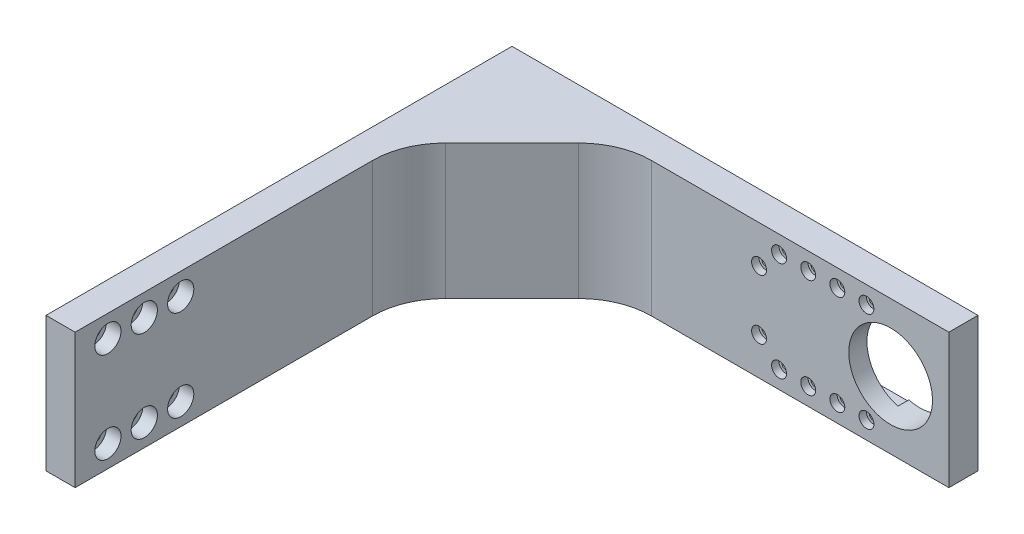
from build123d import *

# Parameters (mm, degrees)
BOSS_EXTRUDE1_DEPTH = 37
CUT_EXTRUDE1_REACH  = 186.762
SKETCH2_R           = 11.5
CUT_EXTRUDE2_REACH  = 186.762
SKETCH3_R           = 1.25
SKETCH5_W           = 38
SKETCH5_H           = 23
CUT_EXTRUDE3_DEPTH  = 3
SKETCH6_W           = 3
SKETCH6_H           = 23
BOSS_EXTRUDE2_DEPTH = 7.5
CUT_EXTRUDE4_REACH  = 184.696
SKETCH7_R           = 1.25
SKETCH8_R           = 2.05
CUT_EXTRUDE5_DEPTH  = 2
CUT_EXTRUDE6_REACH  = 181.313
SKETCH9_R           = 2.25
SKETCH10_R          = 3.6
CUT_EXTRUDE7_DEPTH  = 4
CHAMFER1_SIZE       = 30
FILLET4_R           = 20


with BuildPart() as part:
    # Sketch1 → Boss-Extrude1 (new body)
    with BuildSketch(Plane(origin=(0, 0, 0), x_dir=(1, 0, 0), z_dir=(0, 1, 0))):
        Polygon((0, 0), (0, 128), (128, 128), (128, 120), (8, 120), (8, 0), align=None)
    extrude(amount=BOSS_EXTRUDE1_DEPTH)

    # Sketch2 → Cut-Extrude1 (cut, up to next)
    with BuildSketch(Plane(origin=(0, 0, -128), x_dir=(-1, 0, 0), z_dir=(0, 0, -1)), mode=Mode.PRIVATE) as cut_extrude1_sk1:
        with Locations((-112, 18.5)):
            Circle(SKETCH2_R)
    cut_extrude1_tool1 = extrude(cut_extrude1_sk1.sketch, amount=-CUT_EXTRUDE1_REACH, mode=Mode.PRIVATE) & part.part
    add(cut_extrude1_tool1.solids().sort_by_distance((112, 18.5, -128))[0], mode=Mode.SUBTRACT)

    # Sketch3 → Cut-Extrude2 (cut, up to next)
    with BuildSketch(Plane(origin=(0, 0, -128), x_dir=(-1, 0, 0), z_dir=(0, 0, -1)), mode=Mode.PRIVATE) as cut_extrude2_sk1:
        with Locations((-75.86, 10.31)):
            Circle(SKETCH3_R)
    cut_extrude2_tool1 = extrude(cut_extrude2_sk1.sketch, amount=-CUT_EXTRUDE2_REACH, mode=Mode.PRIVATE) & part.part
    # Sketch3 → Cut-Extrude2 (cut, up to next)
    with BuildSketch(Plane(origin=(0, 0, -128), x_dir=(-1, 0, 0), z_dir=(0, 0, -1)), mode=Mode.PRIVATE) as cut_extrude2_sk2:
        with Locations((-105.36, 32.19)):
            Circle(SKETCH3_R)
    cut_extrude2_tool2 = extrude(cut_extrude2_sk2.sketch, amount=-CUT_EXTRUDE2_REACH, mode=Mode.PRIVATE) & part.part
    # Sketch3 → Cut-Extrude2 (cut, up to next)
    with BuildSketch(Plane(origin=(0, 0, -128), x_dir=(-1, 0, 0), z_dir=(0, 0, -1)), mode=Mode.PRIVATE) as cut_extrude2_sk3:
        with Locations((-97.36, 32.19)):
            Circle(SKETCH3_R)
    cut_extrude2_tool3 = extrude(cut_extrude2_sk3.sketch, amount=-CUT_EXTRUDE2_REACH, mode=Mode.PRIVATE) & part.part
    # Sketch3 → Cut-Extrude2 (cut, up to next)
    with BuildSketch(Plane(origin=(0, 0, -128), x_dir=(-1, 0, 0), z_dir=(0, 0, -1)), mode=Mode.PRIVATE) as cut_extrude2_sk4:
        with Locations((-89.36, 32.19)):
            Circle(SKETCH3_R)
    cut_extrude2_tool4 = extrude(cut_extrude2_sk4.sketch, amount=-CUT_EXTRUDE2_REACH, mode=Mode.PRIVATE) & part.part
    # Sketch3 → Cut-Extrude2 (cut, up to next)
    with BuildSketch(Plane(origin=(0, 0, -128), x_dir=(-1, 0, 0), z_dir=(0, 0, -1)), mode=Mode.PRIVATE) as cut_extrude2_sk5:
        with Locations((-81.36, 32.19)):
            Circle(SKETCH3_R)
    cut_extrude2_tool5 = extrude(cut_extrude2_sk5.sketch, amount=-CUT_EXTRUDE2_REACH, mode=Mode.PRIVATE) & part.part
    # Sketch3 → Cut-Extrude2 (cut, up to next)
    with BuildSketch(Plane(origin=(0, 0, -128), x_dir=(-1, 0, 0), z_dir=(0, 0, -1)), mode=Mode.PRIVATE) as cut_extrude2_sk6:
        with Locations((-81.36, 4.81)):
            Circle(SKETCH3_R)
    cut_extrude2_tool6 = extrude(cut_extrude2_sk6.sketch, amount=-CUT_EXTRUDE2_REACH, mode=Mode.PRIVATE) & part.part
    # Sketch3 → Cut-Extrude2 (cut, up to next)
    with BuildSketch(Plane(origin=(0, 0, -128), x_dir=(-1, 0, 0), z_dir=(0, 0, -1)), mode=Mode.PRIVATE) as cut_extrude2_sk7:
        with Locations((-89.36, 4.81)):
            Circle(SKETCH3_R)
    cut_extrude2_tool7 = extrude(cut_extrude2_sk7.sketch, amount=-CUT_EXTRUDE2_REACH, mode=Mode.PRIVATE) & part.part
    # Sketch3 → Cut-Extrude2 (cut, up to next)
    with BuildSketch(Plane(origin=(0, 0, -128), x_dir=(-1, 0, 0), z_dir=(0, 0, -1)), mode=Mode.PRIVATE) as cut_extrude2_sk8:
        with Locations((-97.36, 4.81)):
            Circle(SKETCH3_R)
    cut_extrude2_tool8 = extrude(cut_extrude2_sk8.sketch, amount=-CUT_EXTRUDE2_REACH, mode=Mode.PRIVATE) & part.part
    # Sketch3 → Cut-Extrude2 (cut, up to next)
    with BuildSketch(Plane(origin=(0, 0, -128), x_dir=(-1, 0, 0), z_dir=(0, 0, -1)), mode=Mode.PRIVATE) as cut_extrude2_sk9:
        with Locations((-105.36, 4.81)):
            Circle(SKETCH3_R)
    cut_extrude2_tool9 = extrude(cut_extrude2_sk9.sketch, amount=-CUT_EXTRUDE2_REACH, mode=Mode.PRIVATE) & part.part
    # Sketch3 → Cut-Extrude2 (cut, up to next)
    with BuildSketch(Plane(origin=(0, 0, -128), x_dir=(-1, 0, 0), z_dir=(0, 0, -1)), mode=Mode.PRIVATE) as cut_extrude2_sk10:
        with Locations((-75.86, 26.69)):
            Circle(SKETCH3_R)
    cut_extrude2_tool10 = extrude(cut_extrude2_sk10.sketch, amount=-CUT_EXTRUDE2_REACH, mode=Mode.PRIVATE) & part.part
    add(cut_extrude2_tool1.solids().sort_by_distance((75.86, 10.31, -128))[0], mode=Mode.SUBTRACT)
    add(cut_extrude2_tool2.solids().sort_by_distance((105.36, 32.19, -128))[0], mode=Mode.SUBTRACT)
    add(cut_extrude2_tool3.solids().sort_by_distance((97.36, 32.19, -128))[0], mode=Mode.SUBTRACT)
    add(cut_extrude2_tool4.solids().sort_by_distance((89.36, 32.19, -128))[0], mode=Mode.SUBTRACT)
    add(cut_extrude2_tool5.solids().sort_by_distance((81.36, 32.19, -128))[0], mode=Mode.SUBTRACT)
    add(cut_extrude2_tool6.solids().sort_by_distance((81.36, 4.81, -128))[0], mode=Mode.SUBTRACT)
    add(cut_extrude2_tool7.solids().sort_by_distance((89.36, 4.81, -128))[0], mode=Mode.SUBTRACT)
    add(cut_extrude2_tool8.solids().sort_by_distance((97.36, 4.81, -128))[0], mode=Mode.SUBTRACT)
    add(cut_extrude2_tool9.solids().sort_by_distance((105.36, 4.81, -128))[0], mode=Mode.SUBTRACT)
    add(cut_extrude2_tool10.solids().sort_by_distance((75.86, 26.69, -128))[0], mode=Mode.SUBTRACT)

    # Sketch5 → Cut-Extrude3 (cut)
    with BuildSketch(Plane(origin=(0, 0, -128), x_dir=(-1, 0, 0), z_dir=(0, 0, -1))):
        with Locations((-90, 18.5)):
            Rectangle(SKETCH5_W, SKETCH5_H)
    extrude(amount=-CUT_EXTRUDE3_DEPTH, mode=Mode.SUBTRACT)

    # Sketch6 → Boss-Extrude2 (add)
    with BuildSketch(Plane(origin=(71, 0, 0), x_dir=(0, 0, -1), z_dir=(1, 0, 0))):
        with Locations((126.5, 18.5)):
            Rectangle(SKETCH6_W, SKETCH6_H)
    extrude(amount=BOSS_EXTRUDE2_DEPTH)

    # Sketch7 → Cut-Extrude4 (cut, up to next)
    with BuildSketch(Plane.XY.offset(-125), mode=Mode.PRIVATE) as cut_extrude4_sk1:
        with Locations(Location((75.86, 10.31, 0), (0, 0, 180))):
            Circle(SKETCH7_R)
    cut_extrude4_tool1 = extrude(cut_extrude4_sk1.sketch, amount=-CUT_EXTRUDE4_REACH, mode=Mode.PRIVATE) & part.part
    # Sketch7 → Cut-Extrude4 (cut, up to next)
    with BuildSketch(Plane.XY.offset(-125), mode=Mode.PRIVATE) as cut_extrude4_sk2:
        with Locations(Location((75.86, 26.69, 0), (0, 0, 180))):
            Circle(SKETCH7_R)
    cut_extrude4_tool2 = extrude(cut_extrude4_sk2.sketch, amount=-CUT_EXTRUDE4_REACH, mode=Mode.PRIVATE) & part.part
    add(cut_extrude4_tool1.solids().sort_by_distance((75.86, 10.31, -125))[0], mode=Mode.SUBTRACT)
    add(cut_extrude4_tool2.solids().sort_by_distance((75.86, 26.69, -125))[0], mode=Mode.SUBTRACT)

    # Sketch8 → Cut-Extrude5 (cut)
    with BuildSketch(Plane.XY.offset(-120)):
        with Locations((75.86, 10.31)):
            Circle(SKETCH8_R)
        with Locations((75.86, 26.69)):
            Circle(SKETCH8_R)
        with Locations((81.36, 32.19)):
            Circle(SKETCH8_R)
        with Locations((89.36, 32.19)):
            Circle(SKETCH8_R)
        with Locations((97.36, 32.19)):
            Circle(SKETCH8_R)
        with Locations((105.36, 32.19)):
            Circle(SKETCH8_R)
        with Locations((105.36, 4.81)):
            Circle(SKETCH8_R)
        with Locations((97.36, 4.81)):
            Circle(SKETCH8_R)
        with Locations((89.36, 4.81)):
            Circle(SKETCH8_R)
        with Locations((81.36, 4.81)):
            Circle(SKETCH8_R)
    extrude(amount=-CUT_EXTRUDE5_DEPTH, mode=Mode.SUBTRACT)

    # Sketch9 → Cut-Extrude6 (cut, up to next)
    with BuildSketch(Plane(origin=(8, 0, 0), x_dir=(0, 0, -1), z_dir=(1, 0, 0)), mode=Mode.PRIVATE) as cut_extrude6_sk1:
        with Locations((29, 31)):
            Circle(SKETCH9_R)
    cut_extrude6_tool1 = extrude(cut_extrude6_sk1.sketch, amount=-CUT_EXTRUDE6_REACH, mode=Mode.PRIVATE) & part.part
    # Sketch9 → Cut-Extrude6 (cut, up to next)
    with BuildSketch(Plane(origin=(8, 0, 0), x_dir=(0, 0, -1), z_dir=(1, 0, 0)), mode=Mode.PRIVATE) as cut_extrude6_sk2:
        with Locations((19, 31)):
            Circle(SKETCH9_R)
    cut_extrude6_tool2 = extrude(cut_extrude6_sk2.sketch, amount=-CUT_EXTRUDE6_REACH, mode=Mode.PRIVATE) & part.part
    # Sketch9 → Cut-Extrude6 (cut, up to next)
    with BuildSketch(Plane(origin=(8, 0, 0), x_dir=(0, 0, -1), z_dir=(1, 0, 0)), mode=Mode.PRIVATE) as cut_extrude6_sk3:
        with Locations((9, 31)):
            Circle(SKETCH9_R)
    cut_extrude6_tool3 = extrude(cut_extrude6_sk3.sketch, amount=-CUT_EXTRUDE6_REACH, mode=Mode.PRIVATE) & part.part
    # Sketch9 → Cut-Extrude6 (cut, up to next)
    with BuildSketch(Plane(origin=(8, 0, 0), x_dir=(0, 0, -1), z_dir=(1, 0, 0)), mode=Mode.PRIVATE) as cut_extrude6_sk4:
        with Locations((19, 6)):
            Circle(SKETCH9_R)
    cut_extrude6_tool4 = extrude(cut_extrude6_sk4.sketch, amount=-CUT_EXTRUDE6_REACH, mode=Mode.PRIVATE) & part.part
    # Sketch9 → Cut-Extrude6 (cut, up to next)
    with BuildSketch(Plane(origin=(8, 0, 0), x_dir=(0, 0, -1), z_dir=(1, 0, 0)), mode=Mode.PRIVATE) as cut_extrude6_sk5:
        with Locations((29, 6)):
            Circle(SKETCH9_R)
    cut_extrude6_tool5 = extrude(cut_extrude6_sk5.sketch, amount=-CUT_EXTRUDE6_REACH, mode=Mode.PRIVATE) & part.part
    # Sketch9 → Cut-Extrude6 (cut, up to next)
    with BuildSketch(Plane(origin=(8, 0, 0), x_dir=(0, 0, -1), z_dir=(1, 0, 0)), mode=Mode.PRIVATE) as cut_extrude6_sk6:
        with Locations((9, 6)):
            Circle(SKETCH9_R)
    cut_extrude6_tool6 = extrude(cut_extrude6_sk6.sketch, amount=-CUT_EXTRUDE6_REACH, mode=Mode.PRIVATE) & part.part
    add(cut_extrude6_tool1.solids().sort_by_distance((8, 31, -29))[0], mode=Mode.SUBTRACT)
    add(cut_extrude6_tool2.solids().sort_by_distance((8, 31, -19))[0], mode=Mode.SUBTRACT)
    add(cut_extrude6_tool3.solids().sort_by_distance((8, 31, -9))[0], mode=Mode.SUBTRACT)
    add(cut_extrude6_tool4.solids().sort_by_distance((8, 6, -19))[0], mode=Mode.SUBTRACT)
    add(cut_extrude6_tool5.solids().sort_by_distance((8, 6, -29))[0], mode=Mode.SUBTRACT)
    add(cut_extrude6_tool6.solids().sort_by_distance((8, 6, -9))[0], mode=Mode.SUBTRACT)

    # Sketch10 → Cut-Extrude7 (cut)
    with BuildSketch(Plane(origin=(8, 0, 0), x_dir=(0, 0, -1), z_dir=(1, 0, 0))):
        with Locations((9, 31)):
            Circle(SKETCH10_R)
        with Locations((19, 31)):
            Circle(SKETCH10_R)
        with Locations((29, 31)):
            Circle(SKETCH10_R)
        with Locations((29, 6)):
            Circle(SKETCH10_R)
        with Locations((19, 6)):
            Circle(SKETCH10_R)
        with Locations((9, 6)):
            Circle(SKETCH10_R)
    extrude(amount=-CUT_EXTRUDE7_DEPTH, mode=Mode.SUBTRACT)

    # Chamfer1
    chamfer1_edges = [part.edges().sort_by_distance(p)[0] for p in [
        (8, 18.5, -120),
    ]]
    chamfer(chamfer1_edges, length=CHAMFER1_SIZE)

    # Fillet4
    fillet4_edges = [part.edges().sort_by_distance(p)[0] for p in [
        (38, 18.5, -120),
        (8, 18.5, -90),
    ]]
    fillet(fillet4_edges, radius=FILLET4_R)


solid = part.part
